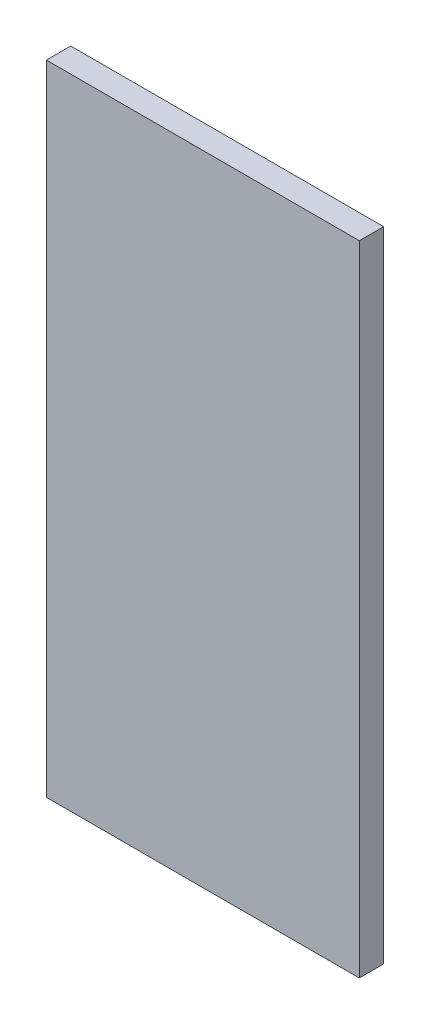
from build123d import *

# Parameters (mm, degrees)
SKETCH1_W           = 245.05
SKETCH1_H           = 500
BOSS_EXTRUDE1_DEPTH = 19.05


with BuildPart() as part:
    # Sketch1 → Boss-Extrude1 (new body)
    with BuildSketch(Plane.XY):
        with Locations((-122.525, 0)):
            Rectangle(SKETCH1_W, SKETCH1_H)
    extrude(amount=BOSS_EXTRUDE1_DEPTH)


solid = part.part
